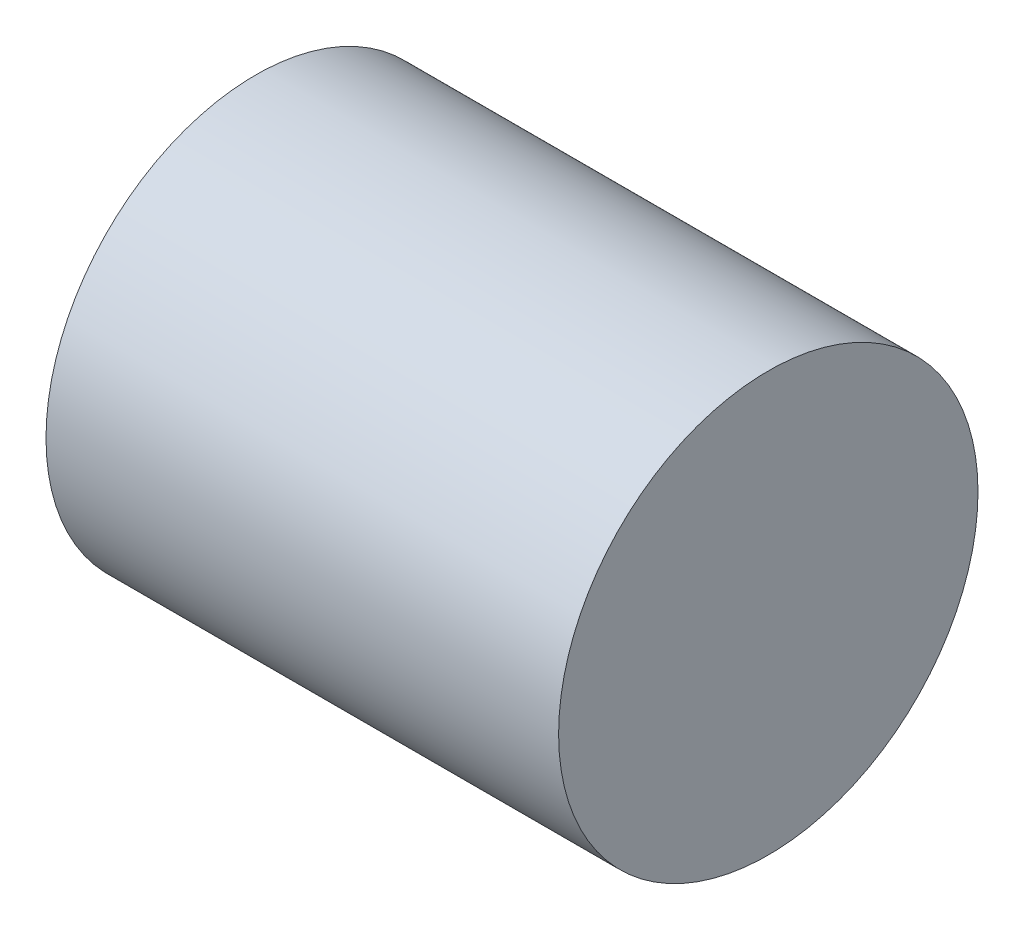
from build123d import *

# Parameters (mm, degrees)
SKETCH_1_R      = 4.5
EXTRUDE_1_DEPTH = 11


with BuildPart() as part:
    # 草图1 → 凸台-拉伸1 (new body)
    with BuildSketch(Plane(origin=(0, 0, 0), x_dir=(0, 0, -1), z_dir=(1, 0, 0))):
        with Locations((-48.288876092, 27.622874036)):
            Circle(SKETCH_1_R)
    extrude(amount=EXTRUDE_1_DEPTH)


solid = part.part
